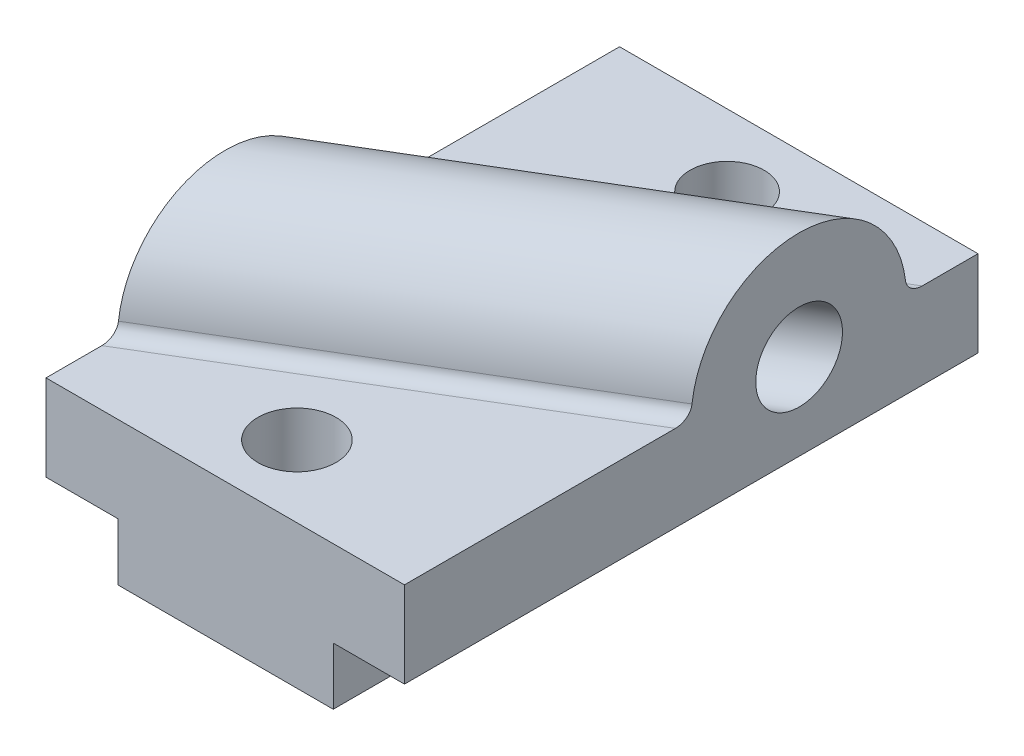
from build123d import *

# Parameters (mm, degrees)
IZIM2_W                     = 50
IZIM2_H                     = 80
Y_KSEKLIK_EKSTR_ZYON1_DEPTH = 12
IZIM7_W                     = 30
IZIM7_H                     = 80
Y_KSEKLIK_EKSTR_ZYON2_DEPTH = 8
Y_KSEKLIK_EKSTR_ZYON3_DEPTH = 58.309518948
IZIM9_R                     = 6.04863379
KES_EKSTR_ZYON2_DEPTH       = 69
RADYUS1_R                   = 2
IZIM10_R                    = 5.458003929
IZIM10_R_2                  = 5.171696766
KES_EKSTR_ZYON3_DEPTH       = 69


with BuildPart() as part:
    # Çizim2 → Yükseklik-Ekstrüzyon1 (new body)
    with BuildSketch(Plane(origin=(0, 0, 0), x_dir=(1, 0, 0), z_dir=(0, 1, 0))):
        with Locations((21.624459622, 0.233673548)):
            Rectangle(IZIM2_W, IZIM2_H)
    extrude(amount=Y_KSEKLIK_EKSTR_ZYON1_DEPTH)

    # Çizim7 → Yükseklik-Ekstrüzyon2 (add)
    with BuildSketch(Plane.XZ):
        with Locations((21.691574622, -0.233673548)):
            Rectangle(IZIM7_W, IZIM7_H)
    extrude(amount=Y_KSEKLIK_EKSTR_ZYON2_DEPTH)

    # Çizim8 → Yükseklik-Ekstrüzyon3 (add, along a direction that is not the sketch's normal)
    with BuildSketch(Plane(origin=(46.624459622, 0, 0), x_dir=(0, 0, -1), z_dir=(1, 0, 0))):
        with BuildLine():
            Line((21.233673548, 12), (30.233673548, 12))
            ThreePointArc((30.233673548, 12), (15.233673548, 27), (0.233673548, 12))
            Line((0.233673548, 12), (9.233673548, 12))
            ThreePointArc((9.233673548, 12), (15.233673548, 18), (21.233673548, 12))
        make_face()
    extrude(amount=-Y_KSEKLIK_EKSTR_ZYON3_DEPTH, dir=(0.8574929257125442, 0, -0.5144957554275265))

    # Çizim9 → Kes-Ekstrüzyon2 (cut, along a direction that is not the sketch's normal)
    with BuildSketch(Plane(origin=(46.624459622, 0, 0), x_dir=(0, 0, -1), z_dir=(1, 0, 0))):
        with Locations((15.282307338, 12)):
            Circle(IZIM9_R)
    extrude(amount=-KES_EKSTR_ZYON2_DEPTH, dir=(0.8574929257125442, 0, -0.5144957554275265), mode=Mode.SUBTRACT)

    # Radyus1
    radyus1_edges = [part.edges().sort_by_distance(p)[0] for p in [
        (21.624459622, 12, 14.766326452),
        (21.624459622, 12, -15.233673548),
    ]]
    fillet(radyus1_edges, radius=RADYUS1_R)

    # Çizim10 → Kes-Ekstrüzyon3 (cut)
    with BuildSketch(Plane(origin=(0, 12, 0), x_dir=(1, 0, 0), z_dir=(0, 1, 0))):
        with Locations(Location((21.624459622, -29.766326452, 0), (0, 0, 270))):
            Circle(IZIM10_R)
        with Locations(Location((21.624459622, 30.233673548, 0), (0, 0, 270))):
            Circle(IZIM10_R_2)
    extrude(amount=-KES_EKSTR_ZYON3_DEPTH, mode=Mode.SUBTRACT)


solid = part.part
